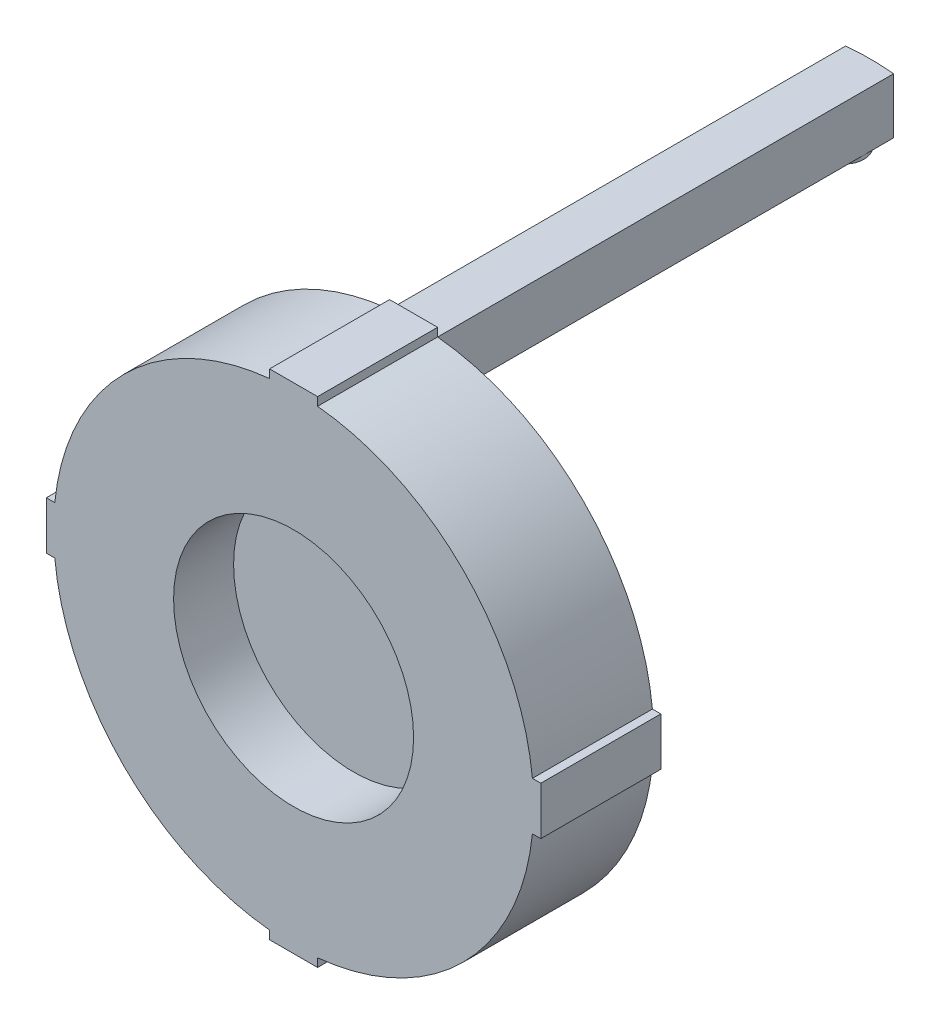
from build123d import *

# Parameters (mm, degrees)
SKETCH1_R           = 5
BOSS_EXTRUDE1_DEPTH = 2.5
SKETCH6_W           = 0.25
SKETCH6_H           = 1
BOSS_EXTRUDE4_DEPTH = 2.5
CIRPATTERN1_COUNT   = 4
SKETCH8_R           = 2.5
CUT_EXTRUDE3_DEPTH  = 1.25
SKETCH9_W           = 1
SKETCH9_H           = 1.35
BOSS_EXTRUDE5_DEPTH = 9.5
SKETCH11_R          = 3.85
CUT_EXTRUDE4_DEPTH  = 14
SKETCH12_R          = 0.48
BOSS_EXTRUDE6_DEPTH = 7
SKETCH13_R          = 3.75
CUT_EXTRUDE5_DEPTH  = 7
CUT_EXTRUDE6_START  = 17
SKETCH14_R          = 6.794989929
SKETCH14_R_2        = 5
CUT_EXTRUDE6_DEPTH  = 17


with BuildPart() as part:
    # Sketch1 → Boss-Extrude1 (new body)
    with BuildSketch(Plane.XY):
        Circle(SKETCH1_R)
    extrude(amount=BOSS_EXTRUDE1_DEPTH)

    # Sketch6 → Boss-Extrude4 (add)
    with BuildSketch(Plane.XY.offset(2.5)):
        with Locations((-5.025, 0)):
            Rectangle(SKETCH6_W, SKETCH6_H)
    boss_extrude4 = extrude(amount=-BOSS_EXTRUDE4_DEPTH)

    # CirPattern1: Boss-Extrude4 ×4 about axis
    cirpattern1_axis = Axis((0, 0, 0), (0, 0, 1))
    for i in range(1, CIRPATTERN1_COUNT):
        add(boss_extrude4.rotate(cirpattern1_axis, i * 360 / CIRPATTERN1_COUNT))

    # Sketch8 → Cut-Extrude3 (cut)
    with BuildSketch(Plane.XY.offset(2.5)):
        Circle(SKETCH8_R)
    extrude(amount=-CUT_EXTRUDE3_DEPTH, mode=Mode.SUBTRACT)

    # Sketch9 → Boss-Extrude5 (add)
    with BuildSketch(Plane(origin=(0, 0, 0), x_dir=(-1, 0, 0), z_dir=(0, 0, -1))):
        with Locations((0, 4.475)):
            Rectangle(SKETCH9_W, SKETCH9_H)
    extrude(amount=BOSS_EXTRUDE5_DEPTH)

    # Sketch11 → Cut-Extrude4 (cut)
    with BuildSketch(Plane(origin=(0, 0, 0), x_dir=(-1, 0, 0), z_dir=(0, 0, -1))):
        Circle(SKETCH11_R)
    extrude(amount=CUT_EXTRUDE4_DEPTH, mode=Mode.SUBTRACT)

    # Sketch12 → Boss-Extrude6 (add)
    with BuildSketch(Plane(origin=(0, 5.15, 0), x_dir=(1, 0, 0), z_dir=(0, 1, 0))):
        with Locations(Location((0, 8.9, 0), (0, 0, 180))):
            Circle(SKETCH12_R)
    extrude(amount=-BOSS_EXTRUDE6_DEPTH)

    # Sketch13 → Cut-Extrude5 (cut)
    with BuildSketch(Plane(origin=(0, 0, -9.5), x_dir=(-1, 0, 0), z_dir=(0, 0, -1))):
        Circle(SKETCH13_R)
    extrude(amount=-CUT_EXTRUDE5_DEPTH, mode=Mode.SUBTRACT)

    # Sketch14 → Cut-Extrude6 (cut)
    with BuildSketch(Plane(origin=(0, 0, 0), x_dir=(-1, 0, 0), z_dir=(0, 0, -1)).offset(CUT_EXTRUDE6_START)):
        Circle(SKETCH14_R)
        Circle(SKETCH14_R_2, mode=Mode.SUBTRACT)
    extrude(amount=-CUT_EXTRUDE6_DEPTH, mode=Mode.SUBTRACT)


solid = part.part
